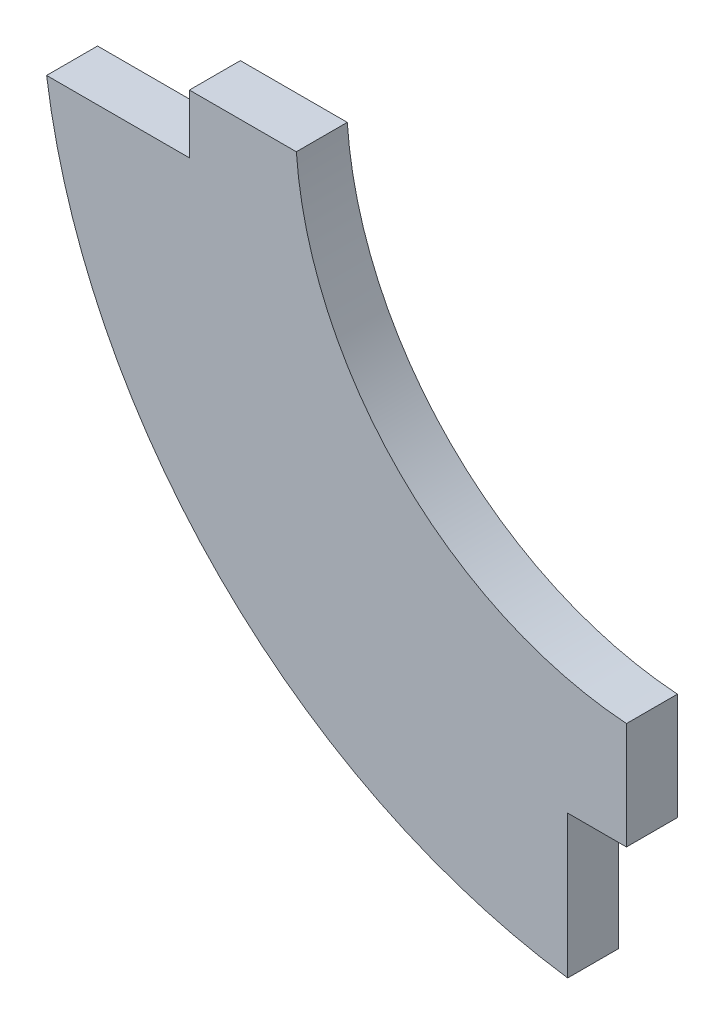
from build123d import *

# Parameters (mm, degrees)
BOSS_EXTRUDE1_DEPTH = 6.35


with BuildPart() as part:
    # Sketch1 → Boss-Extrude1 (new, symmetric)
    with BuildSketch(Plane.XY):
        with BuildLine():
            Line((-6.35, -88.672924278), (-6.35, -115.332))
            Line((-6.35, -115.332), (-21, -115.332))
            Line((-21, -115.332), (-21, -150.946215587))
            ThreePointArc((-21, -150.946215587), (-107.763073453, -107.763073453), (-150.946215587, -21))
            Line((-150.946215587, -21), (-115.332, -21))
            Line((-115.332, -21), (-115.332, -6.35))
            Line((-115.332, -6.35), (-88.672924278, -6.35))
            ThreePointArc((-88.672924278, -6.35), (-62.861792847, -62.861792847), (-6.35, -88.672924278))
        make_face()
    extrude(amount=BOSS_EXTRUDE1_DEPTH, both=True)


solid = part.part
